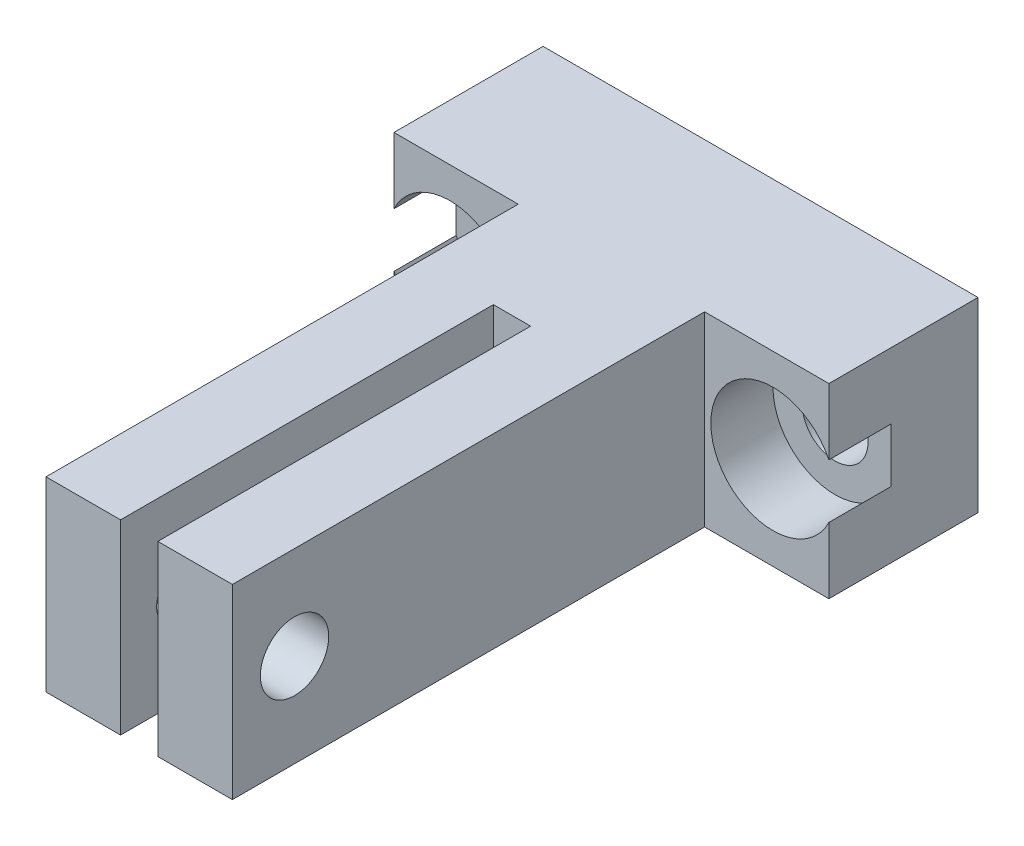
from build123d import *

# Parameters (mm, degrees)
SKETCH_1_W                   = 15
SKETCH_1_H                   = 15
EXTRUDE_1_DEPTH              = 50
SKETCH_2_W                   = 3
SKETCH_2_H                   = 15
CUT_EXTRUDE_1_DEPTH          = 30
SKETCH_3_W                   = 10
SKETCH_3_H                   = 15
EXTRUDE_2_DEPTH              = 12
HOLE_WIZARD_M5_2_D           = 5.3
HOLE_WIZARD_M5_2_CBORE_D     = 10
HOLE_WIZARD_M5_2_CBORE_DEPTH = 5
CUT_EXTRUDE_2_REACH          = 64.081
SKETCH_8_R                   = 2.75
M5X0_8_1_D                   = 4.2


with BuildPart() as part:
    # 草图1 → 凸台-拉伸1 (new body)
    with BuildSketch(Plane.XY):
        with Locations((-186, -19.5)):
            Rectangle(SKETCH_1_W, SKETCH_1_H)
    extrude(amount=EXTRUDE_1_DEPTH)

    # 草图2 → 切除-拉伸1 (cut)
    with BuildSketch(Plane.XY.offset(50)):
        with Locations((-186, -19.5)):
            Rectangle(SKETCH_2_W, SKETCH_2_H)
    extrude(amount=-CUT_EXTRUDE_1_DEPTH, mode=Mode.SUBTRACT)

    # 草图3 → 凸台-拉伸2 (add)
    with BuildSketch(Plane(origin=(0, 0, 0), x_dir=(-1, 0, 0), z_dir=(0, 0, -1))):
        with Locations((173.5, -19.5)):
            Rectangle(SKETCH_3_W, SKETCH_3_H)
        with Locations((198.5, -19.5)):
            Rectangle(SKETCH_3_W, SKETCH_3_H)
    extrude(amount=-EXTRUDE_2_DEPTH)

    # M5 凹头盖螺钉的柱形沉头孔2 (through all)
    with Locations(Plane.XY.offset(12)):
        with Locations((-199, -19.5), (-173, -19.5)):
            CounterBoreHole(HOLE_WIZARD_M5_2_D / 2, HOLE_WIZARD_M5_2_CBORE_D / 2, HOLE_WIZARD_M5_2_CBORE_DEPTH)

    # 草图8 → 切除-拉伸2 (cut, up to next)
    with BuildSketch(Plane(origin=(-178.5, 0, 0), x_dir=(0, 0, -1), z_dir=(1, 0, 0)), mode=Mode.PRIVATE) as cut_extrude_2_sk1:
        with Locations((-45, -19.5)):
            Circle(SKETCH_8_R)
    cut_extrude_2_tool1 = extrude(cut_extrude_2_sk1.sketch, amount=-CUT_EXTRUDE_2_REACH, mode=Mode.PRIVATE) & part.part
    add(cut_extrude_2_tool1.solids().sort_by_distance((-178.5, -19.5, 45))[0], mode=Mode.SUBTRACT)

    # M5x0.8 螺纹孔1 (through all)
    with Locations(Plane(origin=(-187.5, 0, 0), x_dir=(0, 0, -1), z_dir=(1, 0, 0))):
        with Locations((-45, -19.5)):
            Hole(M5X0_8_1_D / 2)


solid = part.part
